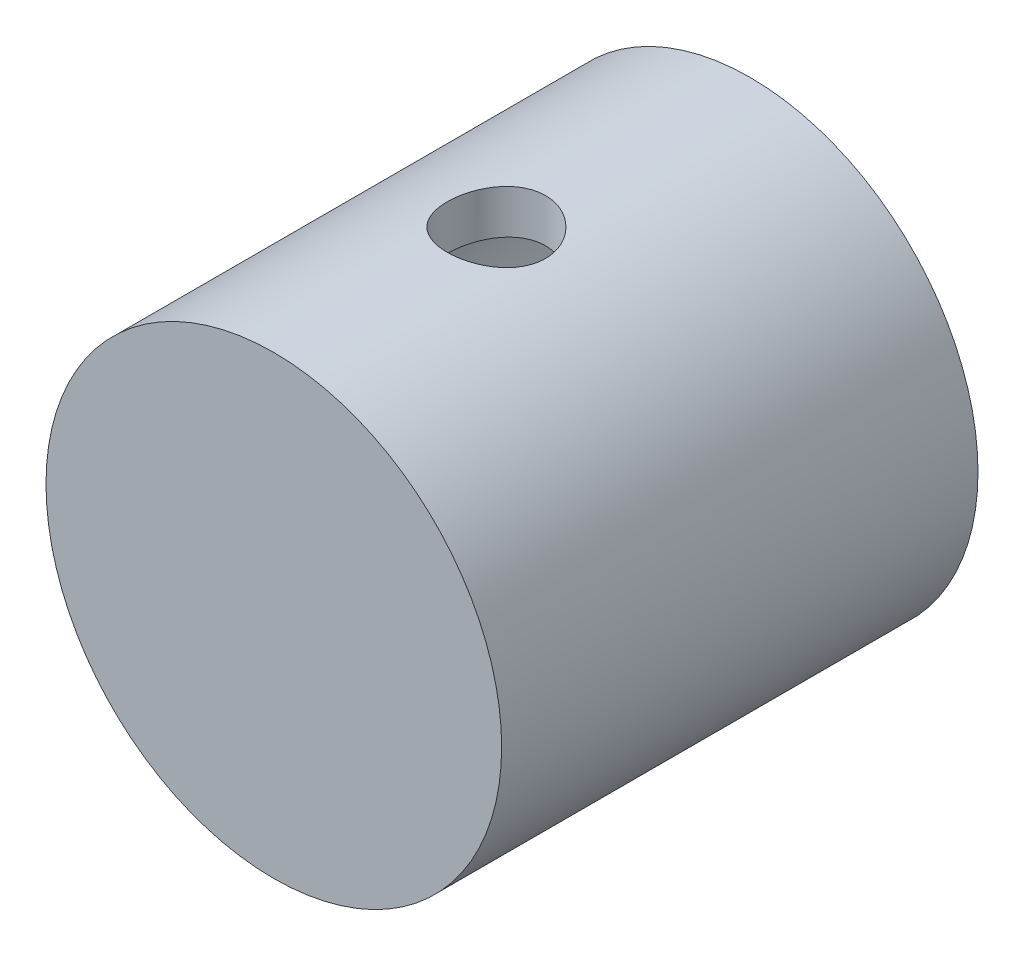
from build123d import *

# Parameters (mm, degrees)
ESBO_O7_R                  = 22
RESSALTO_EXTRUS_O1_DEPTH   = 46
ESBO_O11_R                 = 17.8
CORTE_EXTRUS_O1_DEPTH      = 43
CORTE_EXTRUS_O3_DEPTH      = 56.533773508
CORTE_EXTRUS_O3_DEPTH_BACK = 56.533773508
ESBO_O15_R                 = 4.75


with BuildPart() as part:
    # Esboço7 → Ressalto-extrusão1 (new body)
    with BuildSketch(Plane.XY):
        Circle(ESBO_O7_R)
    extrude(amount=RESSALTO_EXTRUS_O1_DEPTH)

    # Esboço11 → Corte-extrusão1 (cut)
    with BuildSketch(Plane.XY):
        Circle(ESBO_O11_R)
    extrude(amount=CORTE_EXTRUS_O1_DEPTH, mode=Mode.SUBTRACT)

    # Esboço15 → Corte-extrusão3 (cut, two sides: drawn at the far end of the back side and taken through both)
    with BuildSketch(Plane(origin=(0, 0, 0), x_dir=(1, 0, 0), z_dir=(0, 1, 0)).offset(-CORTE_EXTRUS_O3_DEPTH_BACK)):
        with Locations(Location((0, -24.505035598, 0), (0, 0, 270))):
            Circle(ESBO_O15_R)
    extrude(amount=CORTE_EXTRUS_O3_DEPTH + CORTE_EXTRUS_O3_DEPTH_BACK, mode=Mode.SUBTRACT)


solid = part.part
